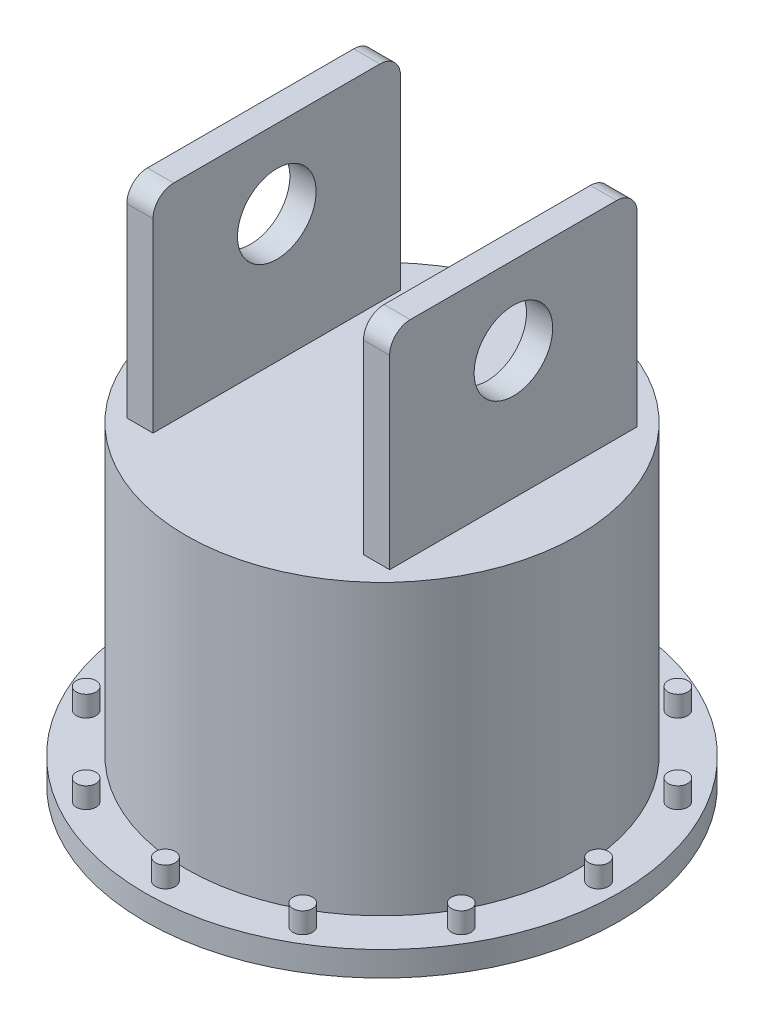
from build123d import *

# Parameters (mm, degrees)
CROQUIS1_R              = 115
SALIENTE_EXTRUIR1_DEPTH = 12
CROQUIS2_R              = 95
SALIENTE_EXTRUIR2_DEPTH = 140
CROQUIS3_R              = 4.7625
SALIENTE_EXTRUIR3_DEPTH = 10
MATRIZC1_COUNT          = 12
CROQUIS4_W              = 12.7
CROQUIS4_H              = 120
SALIENTE_EXTRUIR4_DEPTH = 100
CORTAR_EXTRUIR1_REACH   = 331.64
CROQUIS5_R              = 19.05
REDONDEO1_R             = 10


with BuildPart() as part:
    # Croquis1 → Saliente-Extruir1 (new body)
    with BuildSketch(Plane(origin=(0, 0, 0), x_dir=(1, 0, 0), z_dir=(0, 1, 0))):
        with Locations(Location((0, 0, 0), (0, 0, 270))):
            Circle(CROQUIS1_R)
    extrude(amount=SALIENTE_EXTRUIR1_DEPTH)

    # Croquis2 → Saliente-Extruir2 (add)
    with BuildSketch(Plane(origin=(0, 12, 0), x_dir=(1, 0, 0), z_dir=(0, 1, 0))):
        with Locations(Location((0, 0, 0), (0, 0, 270))):
            Circle(CROQUIS2_R)
    extrude(amount=SALIENTE_EXTRUIR2_DEPTH)

    # Croquis3 → Saliente-Extruir3 (add)
    with BuildSketch(Plane(origin=(0, 12, 0), x_dir=(1, 0, 0), z_dir=(0, 1, 0))):
        with Locations(Location((0, 105, 0), (0, 0, 270))):
            Circle(CROQUIS3_R)
    saliente_extruir3 = extrude(amount=SALIENTE_EXTRUIR3_DEPTH)

    # MatrizC1: Saliente-Extruir3 ×12 about axis
    matrizc1_axis = Axis((0, 0, 0), (0, 1, 0))
    for i in range(1, MATRIZC1_COUNT):
        add(saliente_extruir3.rotate(matrizc1_axis, i * 360 / MATRIZC1_COUNT))

    # Croquis4 → Saliente-Extruir4 (add)
    with BuildSketch(Plane(origin=(0, 152, 0), x_dir=(1, 0, 0), z_dir=(0, 1, 0))):
        with Locations((57.35, 0)):
            Rectangle(CROQUIS4_W, CROQUIS4_H)
        with Locations((-57.35, 0)):
            Rectangle(CROQUIS4_W, CROQUIS4_H)
    extrude(amount=SALIENTE_EXTRUIR4_DEPTH)

    # Cortar-Extruir1: up to this face of the body (flat: up to its plane)
    cortar_extruir1_end = Plane(part.part.faces().sort_by_distance((63.7, 202, 0))[0])
    # Croquis5 → Cortar-Extruir1 (cut, up to the picked face)
    with BuildSketch(Plane.ZY.offset(63.7), mode=Mode.PRIVATE) as cortar_extruir1_sk1:
        with Locations((0, 214)):
            Circle(CROQUIS5_R)
    cortar_extruir1_tool1 = split(extrude(cortar_extruir1_sk1.sketch, amount=-CORTAR_EXTRUIR1_REACH, mode=Mode.PRIVATE), bisect_by=cortar_extruir1_end, keep=Keep.BOTH, mode=Mode.PRIVATE)
    add(cortar_extruir1_tool1.solids().sort_by(Axis((-63.7, 214, 0), (1, 0, 0)))[0], mode=Mode.SUBTRACT)

    # Redondeo1
    redondeo1_edges = [part.edges().sort_by_distance(p)[0] for p in [
        (57.35, 252, 60),
        (57.35, 252, -60),
        (-57.35, 252, 60),
        (-57.35, 252, -60),
    ]]
    fillet(redondeo1_edges, radius=REDONDEO1_R)


solid = part.part
